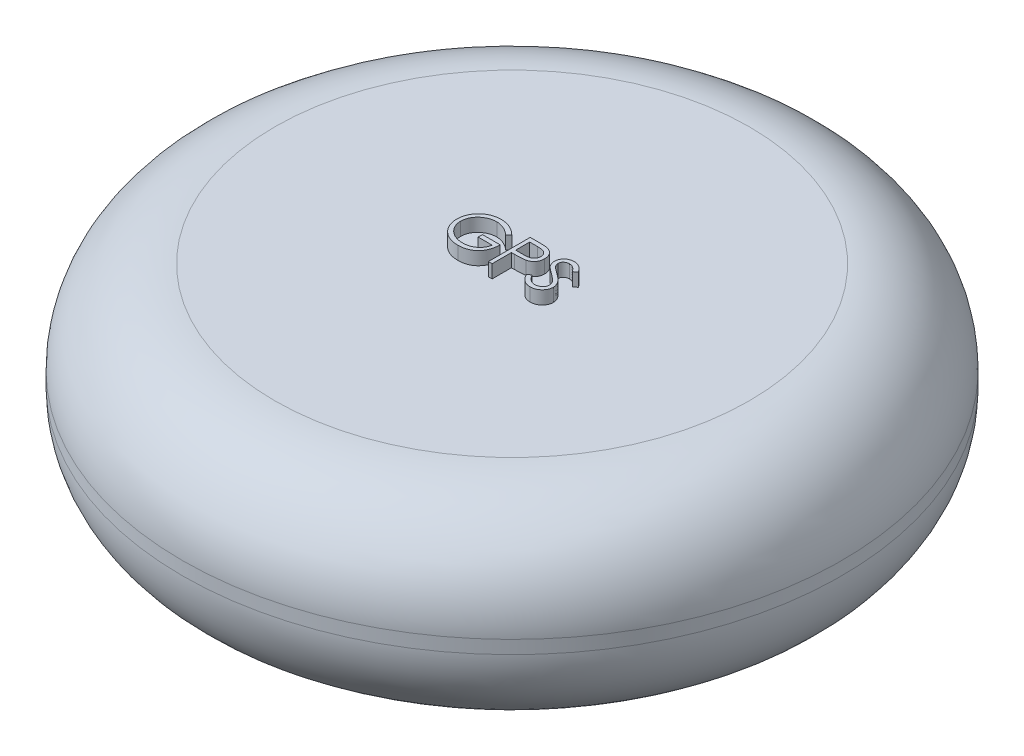
from build123d import *

# Parameters (mm, degrees)
SKETCH1_R           = 25
BOSS_EXTRUDE1_DEPTH = 15
FILLET7_R           = 7
BOSS_EXTRUDE2_DEPTH = 1


with BuildPart() as part:
    # Sketch1 → Boss-Extrude1 (new body)
    with BuildSketch(Plane(origin=(0, 0, 0), x_dir=(1, 0, 0), z_dir=(0, 1, 0))):
        with Locations(Location((0, 0, 0), (0, 0, 270))):
            Circle(SKETCH1_R)
    extrude(amount=BOSS_EXTRUDE1_DEPTH)

    # Fillet7
    fillet7_edges = [part.edges().sort_by_distance(p)[0] for p in [
        (0, 0, -25),
        (0, 15, -25),
    ]]
    fillet(fillet7_edges, radius=FILLET7_R)

    # Sketch2 → Boss-Extrude2 (add)
    # profile 1 of 3: a face of its own
    with BuildSketch(Plane(origin=(0, 15, 0), x_dir=(1, 0, 0), z_dir=(0, 1, 0))):
        with BuildLine():
            Line((-0.902625327, 0.881733039), (-1.146856096, 0.650222623))
            add(Edge.make_bspline(
                [(-1.146856096, 0.650222623), (-1.191051088, 0.691797763), (-1.278387215, 0.77395666), (-1.420772578, 0.88055592), (-1.569329589, 0.971874453), (-1.723283069, 1.046175111), (-1.878820471, 1.105459401), (-2.03387729, 1.147667071), (-2.186863033, 1.174584301), (-2.288614724, 1.177803179), (-2.338753131, 1.179389289)],
                knots=[0, 0, 0, 0, 1.08915593, 2.152340314, 3.188132944, 4.216796309, 5.218260357, 6.173443236, 7.099959455, 8, 8, 8, 8], degree=3))
            add(Edge.make_bspline(
                [(-2.338753131, 1.179389289), (-2.369518609, 1.17901409), (-2.430969773, 1.178264664), (-2.522248251, 1.168699554), (-2.612569415, 1.154942856), (-2.701762762, 1.135038438), (-2.790001714, 1.109811649), (-2.876979381, 1.078256264), (-2.96285801, 1.041466864), (-3.046828669, 0.998955906), (-3.128236126, 0.952256331), (-3.205122684, 0.900505154), (-3.27797841, 0.845361038), (-3.345433939, 0.785443364), (-3.407877287, 0.721294879), (-3.466794738, 0.65410888), (-3.520114142, 0.582049789), (-3.568275413, 0.506443399), (-3.611239167, 0.428617627), (-3.649165589, 0.349321558), (-3.681003662, 0.268818205), (-3.706194525, 0.187006549), (-3.726977761, 0.104519513), (-3.741598733, 0.020785945), (-3.749841688, -0.064283812), (-3.751267517, -0.121249896), (-3.751984301, -0.149887554)],
                knots=[0, 0, 0, 0, 1.02818874, 2.053710826, 3.065248034, 4.081641283, 5.106893873, 6.131558223, 7.173050175, 8.228653731, 9.27666206, 10.308777013, 11.325269123, 12.329503258, 13.32196095, 14.316845687, 15.314881793, 16.315733098, 17.311955233, 18.285320748, 19.252783886, 20.203351036, 21.145449891, 22.095197417, 23.042428769, 24, 24, 24, 24], degree=3))
            add(Edge.make_bspline(
                [(-3.751984301, -0.149887554), (-3.751298757, -0.179161795), (-3.74992954, -0.237630339), (-3.74116625, -0.324892105), (-3.724902775, -0.410857863), (-3.703160639, -0.495810098), (-3.675963756, -0.579894302), (-3.642061409, -0.662745936), (-3.601906186, -0.744361933), (-3.555427314, -0.824006914), (-3.5044584, -0.901588514), (-3.447360034, -0.974667509), (-3.386707933, -1.044217043), (-3.320292467, -1.108692914), (-3.250243311, -1.169819734), (-3.174467603, -1.225913386), (-3.094455371, -1.278054346), (-3.010084544, -1.325585474), (-2.922270591, -1.368047503), (-2.832230536, -1.405806323), (-2.739676732, -1.436902579), (-2.645095578, -1.462246431), (-2.548599824, -1.483020272), (-2.44969966, -1.496384736), (-2.349122275, -1.506082847), (-2.281323659, -1.506791933), (-2.247166593, -1.507149172)],
                knots=[0, 0, 0, 0, 0.93586088, 1.869166235, 2.799637598, 3.729985548, 4.670839027, 5.622275134, 6.589130586, 7.576015415, 8.568469353, 9.55398029, 10.53834874, 11.515998671, 12.510579167, 13.508179873, 14.527009472, 15.561807829, 16.601455013, 17.643573243, 18.680854198, 19.719860599, 20.772568776, 21.833555941, 22.908541556, 24, 24, 24, 24], degree=3))
            add(Edge.make_bspline(
                [(-2.247166593, -1.507149172), (-2.206001949, -1.506288678), (-2.125168484, -1.504598958), (-2.006345068, -1.491445124), (-1.892223711, -1.470901247), (-1.783125084, -1.44081504), (-1.678922472, -1.402439564), (-1.579233875, -1.356179463), (-1.484844156, -1.300260403), (-1.395469563, -1.237146966), (-1.313139831, -1.166829939), (-1.238886447, -1.090952469), (-1.173893753, -1.009882866), (-1.117193061, -0.924098616), (-1.070285925, -0.83288966), (-1.031784247, -0.736702979), (-1.002271904, -0.635495307), (-0.990157033, -0.565562184), (-0.984035583, -0.530226095)],
                knots=[0, 0, 0, 0, 1.13008108, 2.219097802, 3.278683437, 4.311054135, 5.322181354, 6.324827112, 7.324222904, 8.330512327, 9.32562643, 10.293043162, 11.24128371, 12.174520618, 13.111833804, 14.052305215, 15.015860969, 16, 16, 16, 16], degree=3))
            Line((-0.984035583, -0.530226095), (-2.042368917, -0.530226095))
            Line((-2.042368917, -0.530226095), (-2.042368917, -0.20458507))
            Line((-2.042368917, -0.20458507), (-0.699099686, -0.20458507))
            add(Edge.make_bspline(
                [(-0.699099686, -0.20458507), (-0.700647134, -0.26527972), (-0.70367577, -0.384070115), (-0.724920072, -0.557307432), (-0.759225051, -0.720930326), (-0.806088334, -0.875111112), (-0.866753766, -1.0196313), (-0.940570274, -1.154637621), (-1.02871927, -1.279257896), (-1.128060885, -1.394509492), (-1.239548704, -1.497315277), (-1.360170237, -1.587672093), (-1.490124773, -1.663783751), (-1.629289384, -1.725705923), (-1.777208492, -1.774033047), (-1.934224379, -1.808297263), (-2.100124117, -1.828825873), (-2.213822388, -1.831448767), (-2.27197128, -1.832790198)],
                knots=[0, 0, 0, 0, 1.140356446, 2.231883559, 3.274166699, 4.278491846, 5.25512956, 6.21435461, 7.1637429, 8.11826594, 9.068280886, 10.0076534, 10.945064095, 11.891975133, 12.864533718, 13.863980011, 14.907571808, 16, 16, 16, 16], degree=3))
            add(Edge.make_bspline(
                [(-2.27197128, -1.832790198), (-2.307812618, -1.832273924), (-2.378503286, -1.831255664), (-2.482907199, -1.824019071), (-2.584432469, -1.812878834), (-2.683064306, -1.796055757), (-2.779165516, -1.775450321), (-2.87225614, -1.749064512), (-2.962690791, -1.718522192), (-3.05060925, -1.683782545), (-3.135213517, -1.643531114), (-3.216880429, -1.598800226), (-3.296061415, -1.549820535), (-3.372217114, -1.495744982), (-3.445744328, -1.436978036), (-3.516168952, -1.373401909), (-3.583885241, -1.305210965), (-3.626303662, -1.256788578), (-3.64767741, -1.232389557)],
                knots=[0, 0, 0, 0, 1.107784379, 2.184907829, 3.233506516, 4.263428166, 5.276301166, 6.270063455, 7.25232949, 8.225834625, 9.190232166, 10.146266622, 11.1027726, 12.066435141, 13.031522626, 14.010570082, 14.99756817, 16, 16, 16, 16], degree=3))
            add(Edge.make_bspline(
                [(-3.64767741, -1.232389557), (-3.678688934, -1.193681179), (-3.740197223, -1.116906942), (-3.819370979, -0.993898421), (-3.88686368, -0.866533876), (-3.941625919, -0.734458749), (-3.984386897, -0.597796577), (-4.015053998, -0.456721992), (-4.033022039, -0.311053327), (-4.035610605, -0.212478408), (-4.036920199, -0.162607906)],
                knots=[0, 0, 0, 0, 1.023165419, 2.029347347, 3.013907458, 3.994755782, 4.975994455, 5.96558838, 6.970761222, 8, 8, 8, 8], degree=3))
            add(Edge.make_bspline(
                [(-4.036920199, -0.162607906), (-4.036437383, -0.125264234), (-4.035477887, -0.051051505), (-4.023843312, 0.059127624), (-4.007150597, 0.167350394), (-3.982615054, 0.273528342), (-3.951684871, 0.377732379), (-3.91308278, 0.480010889), (-3.868138482, 0.580424229), (-3.81590021, 0.678281238), (-3.757766451, 0.772283384), (-3.694674465, 0.862052249), (-3.625728342, 0.945953043), (-3.55205401, 1.025048324), (-3.472772454, 1.098344421), (-3.388626406, 1.166519936), (-3.299551016, 1.229666319), (-3.205266053, 1.286788955), (-3.107178796, 1.338100239), (-3.005524366, 1.383084738), (-2.900333794, 1.42026246), (-2.792395154, 1.451807246), (-2.680891421, 1.475134552), (-2.566631756, 1.492051628), (-2.449020582, 1.503627315), (-2.369522184, 1.504558275), (-2.329212867, 1.505030315)],
                knots=[0, 0, 0, 0, 1.008945113, 2.00506715, 2.99143336, 3.967273523, 4.948097931, 5.927297278, 6.919902385, 7.919676788, 8.923139349, 9.905703106, 10.883022732, 11.856032218, 12.825136022, 13.798837087, 14.781400844, 15.773989409, 16.776158564, 17.77167057, 18.775803737, 19.789618931, 20.80898985, 21.851988756, 22.910860228, 24, 24, 24, 24], degree=3))
            add(Edge.make_bspline(
                [(-2.329212867, 1.505030315), (-2.296339603, 1.504504633), (-2.231155784, 1.503462268), (-2.13415887, 1.496237194), (-2.038661206, 1.484785531), (-1.944521195, 1.469158374), (-1.85205942, 1.447873455), (-1.76101248, 1.42240244), (-1.671248394, 1.392746286), (-1.583048482, 1.357377833), (-1.495819697, 1.317233473), (-1.409077027, 1.272045583), (-1.323116854, 1.221041472), (-1.237790107, 1.164069693), (-1.152558721, 1.102108735), (-1.068770796, 1.033386474), (-0.984403839, 0.960612974), (-0.930155051, 0.908286993), (-0.902625327, 0.881733039)],
                knots=[0, 0, 0, 0, 0.985871117, 1.954866573, 2.915460327, 3.869826059, 4.81536089, 5.759505086, 6.70452669, 7.649098992, 8.607881297, 9.583363685, 10.581137262, 11.603961102, 12.659522466, 13.73993555, 14.853081303, 16, 16, 16, 16], degree=3))
        make_face()
    # profile 2 of 3: a face of its own
    with BuildSketch(Plane(origin=(0, 15, 0), x_dir=(1, 0, 0), z_dir=(0, 1, 0))):
        with BuildLine():
            Line((-0.047817635, 1.423620059), (0.574843623, 1.423620059))
            add(Edge.make_bspline(
                [(0.574843623, 1.423620059), (0.61767066, 1.423572981), (0.699729163, 1.423482779), (0.817399249, 1.420747974), (0.924269506, 1.417095189), (1.020109494, 1.412031614), (1.105214098, 1.406047565), (1.179198219, 1.397654643), (1.242643388, 1.388891375), (1.280658525, 1.379981956), (1.297995667, 1.375918736)],
                knots=[0, 0, 0, 0, 1.415646017, 2.712440637, 3.8905458, 4.950247383, 5.884950622, 6.709939814, 7.411656543, 8, 8, 8, 8], degree=3))
            add(Edge.make_bspline(
                [(1.297995667, 1.375918736), (1.319942658, 1.369911682), (1.363319487, 1.358039122), (1.425822576, 1.33425953), (1.485289279, 1.306063566), (1.541923621, 1.273928992), (1.595029654, 1.236477087), (1.645399705, 1.195226019), (1.692589259, 1.149223382), (1.73633295, 1.09898514), (1.776505588, 1.045354663), (1.811094657, 0.987531355), (1.840057213, 0.92648853), (1.864897752, 0.862268647), (1.882776136, 0.794332425), (1.896244395, 0.723151908), (1.904792972, 0.648734724), (1.905611724, 0.597880416), (1.906028519, 0.571992454)],
                knots=[0, 0, 0, 0, 0.999701418, 1.975846123, 2.934577507, 3.890451536, 4.834027766, 5.787354733, 6.749476667, 7.726910423, 8.712836071, 9.690891519, 10.682875813, 11.679750201, 12.712814741, 13.765529915, 14.8625177, 16, 16, 16, 16], degree=3))
            add(Edge.make_bspline(
                [(1.906028519, 0.571992454), (1.905646227, 0.5458869), (1.904898246, 0.494809619), (1.895920901, 0.420085732), (1.883828513, 0.348676907), (1.865234759, 0.280741477), (1.840881898, 0.216682885), (1.812314107, 0.155522196), (1.777857619, 0.098299922), (1.738265523, 0.044808323), (1.694222291, -0.005002812), (1.645914269, -0.050772518), (1.593536482, -0.092232882), (1.537255391, -0.129476851), (1.476522313, -0.161640762), (1.41225836, -0.190449174), (1.343904949, -0.214643636), (1.29660424, -0.227370906), (1.272554962, -0.233841881)],
                knots=[0, 0, 0, 0, 1.121902311, 2.195077645, 3.232258892, 4.234102512, 5.217864754, 6.176164875, 7.132989551, 8.084763148, 9.034132444, 9.988522005, 10.94243251, 11.903244335, 12.886203696, 13.894208494, 14.929344452, 16, 16, 16, 16], degree=3))
            add(Edge.make_bspline(
                [(1.272554962, -0.233841881), (1.252663737, -0.238071871), (1.209070962, -0.24734214), (1.137277207, -0.25769124), (1.053688178, -0.266524635), (0.958417967, -0.273147809), (0.851552089, -0.278817786), (0.733032735, -0.283324557), (0.60262725, -0.285800925), (0.511666907, -0.285928644), (0.464176556, -0.285995326)],
                knots=[0, 0, 0, 0, 0.601384939, 1.31797006, 2.144135048, 3.087295005, 4.142315834, 5.309527816, 6.595305764, 8, 8, 8, 8], degree=3))
            Line((0.464176556, -0.285995326), (0.237118263, -0.285995326))
            Line((0.237118263, -0.285995326), (0.237118263, -1.751379941))
            Line((0.237118263, -1.751379941), (-0.047817635, -1.751379941))
            Line((-0.047817635, -1.751379941), (-0.047817635, 1.423620059))
        make_face()
        with BuildLine():
            Line((0.237118263, 1.097979033), (0.237118263, 0.0396457))
            Line((0.237118263, 0.0396457), (0.79299767, 0.032649506))
            add(Edge.make_bspline(
                [(0.79299767, 0.032649506), (0.820139317, 0.032635478), (0.872535707, 0.032608398), (0.948224281, 0.036223565), (1.018445563, 0.040396905), (1.082983856, 0.04650735), (1.141868254, 0.055144491), (1.195196941, 0.06386371), (1.242556405, 0.076477861), (1.297982109, 0.093462359), (1.359743431, 0.122429803), (1.426933279, 0.164475775), (1.483875168, 0.218070417), (1.533149623, 0.27832995), (1.572252812, 0.345367017), (1.600878605, 0.417093839), (1.617698084, 0.492774816), (1.619953416, 0.544561914), (1.621092622, 0.570720419)],
                knots=[0, 0, 0, 0, 1.160613943, 2.240541288, 3.23993089, 4.169200891, 5.011653406, 5.7853311, 6.478053781, 7.106038997, 8.262395093, 9.384106736, 10.481365981, 11.59014053, 12.70357646, 13.786202915, 14.881775077, 16, 16, 16, 16], degree=3))
            add(Edge.make_bspline(
                [(1.621092622, 0.570720419), (1.619947221, 0.596246071), (1.617670306, 0.646987907), (1.600746773, 0.721354354), (1.572308467, 0.792325314), (1.532887128, 0.858522327), (1.485043388, 0.918565028), (1.429436127, 0.970723136), (1.36619624, 1.012652824), (1.30736963, 1.039715872), (1.255117126, 1.056239729), (1.209730991, 1.06780112), (1.158485879, 1.077031848), (1.101365108, 1.084506255), (1.038811408, 1.090904752), (0.970287366, 1.095246317), (0.896052561, 1.097787638), (0.844517257, 1.09791369), (0.817802357, 1.097979033)],
                knots=[0, 0, 0, 0, 1.120700087, 2.227813068, 3.331159281, 4.466773991, 5.599788987, 6.693661531, 7.80175334, 8.91857717, 9.525282508, 10.207424825, 10.974604443, 11.810962634, 12.737642355, 13.736264703, 14.826523623, 16, 16, 16, 16], degree=3))
            Line((0.817802357, 1.097979033), (0.237118263, 1.097979033))
        make_face(mode=Mode.SUBTRACT)
    # profile 3 of 3: a face of its own
    with BuildSketch(Plane(origin=(0, 15, 0), x_dir=(1, 0, 0), z_dir=(0, 1, 0))):
        with BuildLine():
            Line((2.231669545, -1.138894965), (2.500068984, -0.977982506))
            add(Edge.make_bspline(
                [(2.500068984, -0.977982506), (2.525031956, -1.019769483), (2.572860048, -1.09983172), (2.652644495, -1.2080158), (2.735315065, -1.299965756), (2.82148396, -1.375146679), (2.910625213, -1.43433674), (3.003320748, -1.476248765), (3.09925819, -1.502388971), (3.164548728, -1.50556405), (3.197144304, -1.507149172)],
                knots=[0, 0, 0, 0, 1.272034388, 2.437168799, 3.508375237, 4.49857839, 5.41946034, 6.295179144, 7.148887113, 8, 8, 8, 8], degree=3))
            add(Edge.make_bspline(
                [(3.197144304, -1.507149172), (3.224981671, -1.506373862), (3.280169315, -1.504836808), (3.361415064, -1.490067795), (3.440319984, -1.467378221), (3.51525782, -1.434883519), (3.585194556, -1.395569321), (3.646523487, -1.34808386), (3.699542461, -1.294919659), (3.742912158, -1.235608251), (3.77618619, -1.171820552), (3.801760423, -1.106346653), (3.81595274, -1.038158023), (3.818090652, -0.992247103), (3.819169545, -0.969078259)],
                knots=[0, 0, 0, 0, 1.095163259, 2.171163733, 3.241058638, 4.321873601, 5.38011039, 6.391990106, 7.366004449, 8.327778327, 9.272591725, 10.192022065, 11.087607919, 12, 12, 12, 12], degree=3))
            add(Edge.make_bspline(
                [(3.819169545, -0.969078259), (3.817832134, -0.942643345), (3.815113374, -0.888905029), (3.792134103, -0.809621058), (3.755985144, -0.731159941), (3.722636174, -0.68262665), (3.705322389, -0.657429621)],
                knots=[0, 0, 0, 0, 0.938893495, 1.908633276, 2.914225137, 4, 4, 4, 4], degree=3))
            add(Edge.make_bspline(
                [(3.705322389, -0.657429621), (3.691106904, -0.639244288), (3.66126327, -0.601066457), (3.609957526, -0.544238279), (3.549753979, -0.485620141), (3.482712897, -0.422973711), (3.406392167, -0.359212639), (3.323182207, -0.291296415), (3.230958564, -0.221807841), (3.166279735, -0.175205586), (3.132906524, -0.151159589)],
                knots=[0, 0, 0, 0, 0.722233717, 1.516239348, 2.393582979, 3.351407094, 4.387010283, 5.505090956, 6.712668013, 8, 8, 8, 8], degree=3))
            add(Edge.make_bspline(
                [(3.132906524, -0.151159589), (3.099501899, -0.127366513), (3.035634799, -0.081875964), (2.9463188, -0.014362506), (2.866449894, 0.047363004), (2.796383072, 0.103881644), (2.736149152, 0.155201078), (2.685273486, 0.200828494), (2.645052081, 0.241997867), (2.622685947, 0.26870537), (2.612644104, 0.280696381)],
                knots=[0, 0, 0, 0, 1.452282411, 2.77665338, 3.964542531, 5.026858415, 5.96415736, 6.766646006, 7.446254459, 8, 8, 8, 8], degree=3))
            add(Edge.make_bspline(
                [(2.612644104, 0.280696381), (2.598608295, 0.299384464), (2.571004993, 0.336137088), (2.534568688, 0.393581781), (2.503599591, 0.452385743), (2.479322332, 0.512706991), (2.458878762, 0.573698677), (2.445128354, 0.636156593), (2.436518301, 0.699800482), (2.43563657, 0.742629872), (2.435195186, 0.764069778)],
                knots=[0, 0, 0, 0, 1.068054152, 2.10047183, 3.106115577, 4.101338837, 5.06977816, 6.043150881, 7.020423561, 8, 8, 8, 8], degree=3))
            add(Edge.make_bspline(
                [(2.435195186, 0.764069778), (2.436379197, 0.797661074), (2.438721912, 0.864125674), (2.458534381, 0.961217928), (2.48980622, 1.053915606), (2.533616583, 1.14130098), (2.590092896, 1.221098691), (2.655448887, 1.29422664), (2.733292163, 1.355702426), (2.818702043, 1.409416222), (2.912188895, 1.451458597), (3.010152072, 1.4831732), (3.112747273, 1.501143027), (3.182237259, 1.50372182), (3.217496869, 1.505030315)],
                knots=[0, 0, 0, 0, 1.005424448, 1.989358655, 2.955360095, 3.929531133, 4.905563448, 5.876582895, 6.856512386, 7.866279853, 8.892233794, 9.918561126, 10.94386622, 12, 12, 12, 12], degree=3))
            add(Edge.make_bspline(
                [(3.217496869, 1.505030315), (3.25491116, 1.503739857), (3.329316243, 1.501173549), (3.438762317, 1.478860074), (3.544136681, 1.441938751), (3.628903071, 1.40003904), (3.695244934, 1.358191255), (3.74583877, 1.320073272), (3.797108171, 1.276190138), (3.849466693, 1.226424964), (3.902027148, 1.170321126), (3.955569851, 1.108262858), (4.010220009, 1.040629411), (4.045377111, 0.992347185), (4.063400314, 0.967595419)],
                knots=[0, 0, 0, 0, 1.286793592, 2.559021753, 3.825965368, 5.121522368, 5.803751409, 6.523245864, 7.299691795, 8.125521123, 9.008227632, 9.944561021, 10.946284179, 12, 12, 12, 12], degree=3))
            Line((4.063400314, 0.967595419), (3.805813175, 0.772338007))
            add(Edge.make_bspline(
                [(3.805813175, 0.772338007), (3.790259364, 0.792375605), (3.760306363, 0.830963333), (3.714831757, 0.885003027), (3.671970483, 0.934366547), (3.629742621, 0.977242771), (3.590378398, 1.015979706), (3.552172224, 1.049144628), (3.515673919, 1.07706249), (3.469666436, 1.106856291), (3.411865363, 1.13638969), (3.339307962, 1.16138064), (3.26348327, 1.176398446), (3.211839962, 1.17838408), (3.185695987, 1.179389289)],
                knots=[0, 0, 0, 0, 1.181633172, 2.275549214, 3.290209073, 4.226197932, 5.078386478, 5.862611352, 6.581680152, 7.217281963, 8.414376989, 9.595101626, 10.782541182, 12, 12, 12, 12], degree=3))
            add(Edge.make_bspline(
                [(3.185695987, 1.179389289), (3.152896856, 1.178290104), (3.089646822, 1.17617043), (2.999848536, 1.153020157), (2.919027618, 1.11656947), (2.849583506, 1.06548374), (2.791764962, 1.004958268), (2.749940725, 0.935308878), (2.724767361, 0.858399127), (2.721695522, 0.804749196), (2.720131083, 0.777426148)],
                knots=[0, 0, 0, 0, 1.14458467, 2.207223713, 3.21896685, 4.227309161, 5.202851033, 6.127160689, 7.046193047, 8, 8, 8, 8], degree=3))
            add(Edge.make_bspline(
                [(2.720131083, 0.777426148), (2.720487705, 0.760415878), (2.721201533, 0.726367524), (2.731157242, 0.676065162), (2.743947347, 0.625889876), (2.764215306, 0.576067247), (2.792196403, 0.525725936), (2.828940384, 0.473999074), (2.875216746, 0.420430738), (2.910665178, 0.385589763), (2.929380883, 0.367194778)],
                knots=[0, 0, 0, 0, 0.858281714, 1.717966888, 2.583508476, 3.4729293, 4.427298488, 5.488583878, 6.674047936, 8, 8, 8, 8], degree=3))
            add(Edge.make_bspline(
                [(2.929380883, 0.367194778), (2.936330842, 0.360992619), (2.952842355, 0.346257709), (2.983028373, 0.322134711), (3.022890768, 0.292377911), (3.071388622, 0.255559416), (3.129416158, 0.212849804), (3.196979755, 0.16479517), (3.273326288, 0.109835504), (3.327502598, 0.071411164), (3.356148712, 0.051094017)],
                knots=[0, 0, 0, 0, 0.420754252, 0.999615792, 1.744751191, 2.668019286, 3.750313428, 4.999500688, 6.413464383, 8, 8, 8, 8], degree=3))
            add(Edge.make_bspline(
                [(3.356148712, 0.051094017), (3.390607361, 0.026019355), (3.457331761, -0.022534252), (3.552271137, -0.095482762), (3.638353377, -0.166827524), (3.715880712, -0.236112924), (3.78561905, -0.302813409), (3.846794697, -0.367731437), (3.900030993, -0.43040192), (3.95734357, -0.5107499), (4.015906734, -0.609429883), (4.066200102, -0.730332285), (4.097912317, -0.851704662), (4.102059335, -0.933281149), (4.104105442, -0.973530382)],
                knots=[0, 0, 0, 0, 1.163667725, 2.253281268, 3.268753668, 4.215851969, 5.092017293, 5.902905408, 6.650798638, 7.335211899, 8.59617414, 9.77448103, 10.901945474, 12, 12, 12, 12], degree=3))
            add(Edge.make_bspline(
                [(4.104105442, -0.973530382), (4.103509324, -1.001995042), (4.102328664, -1.058371597), (4.088756978, -1.141152988), (4.06887271, -1.221553849), (4.038903219, -1.298580358), (4.002324354, -1.373641678), (3.955909258, -1.444768845), (3.902108716, -1.513536078), (3.840392372, -1.578109674), (3.772859303, -1.637388009), (3.701481952, -1.690119371), (3.62614349, -1.734087065), (3.547252617, -1.769965329), (3.464791211, -1.798026448), (3.378787007, -1.818358122), (3.289098237, -1.830836517), (3.2281378, -1.832131701), (3.197144304, -1.832790198)],
                knots=[0, 0, 0, 0, 0.983748083, 1.948392443, 2.894712957, 3.844097841, 4.80183111, 5.778335162, 6.776009319, 7.81870978, 8.863265674, 9.881300176, 10.883814829, 11.87499822, 12.874611388, 13.892143829, 14.928324115, 16, 16, 16, 16], degree=3))
            add(Edge.make_bspline(
                [(3.197144304, -1.832790198), (3.173163672, -1.832326483), (3.125504418, -1.831404894), (3.055010817, -1.823257589), (2.985941332, -1.811730431), (2.919162662, -1.793429668), (2.853814439, -1.771225553), (2.790180876, -1.74388578), (2.728231134, -1.711122318), (2.667618041, -1.673661832), (2.608495754, -1.630066592), (2.551418808, -1.579290634), (2.494514476, -1.522734355), (2.439462338, -1.458861915), (2.385148842, -1.388705226), (2.332644857, -1.311607895), (2.280863584, -1.227989867), (2.248373838, -1.169147968), (2.231669545, -1.138894965)],
                knots=[0, 0, 0, 0, 0.915332311, 1.819136955, 2.706846663, 3.586547465, 4.459518054, 5.340707479, 6.227863349, 7.133153174, 8.059268498, 9.028702269, 10.047606654, 11.120612155, 12.245963614, 13.433783089, 14.680604001, 16, 16, 16, 16], degree=3))
        make_face()
    extrude(amount=BOSS_EXTRUDE2_DEPTH)


solid = part.part
